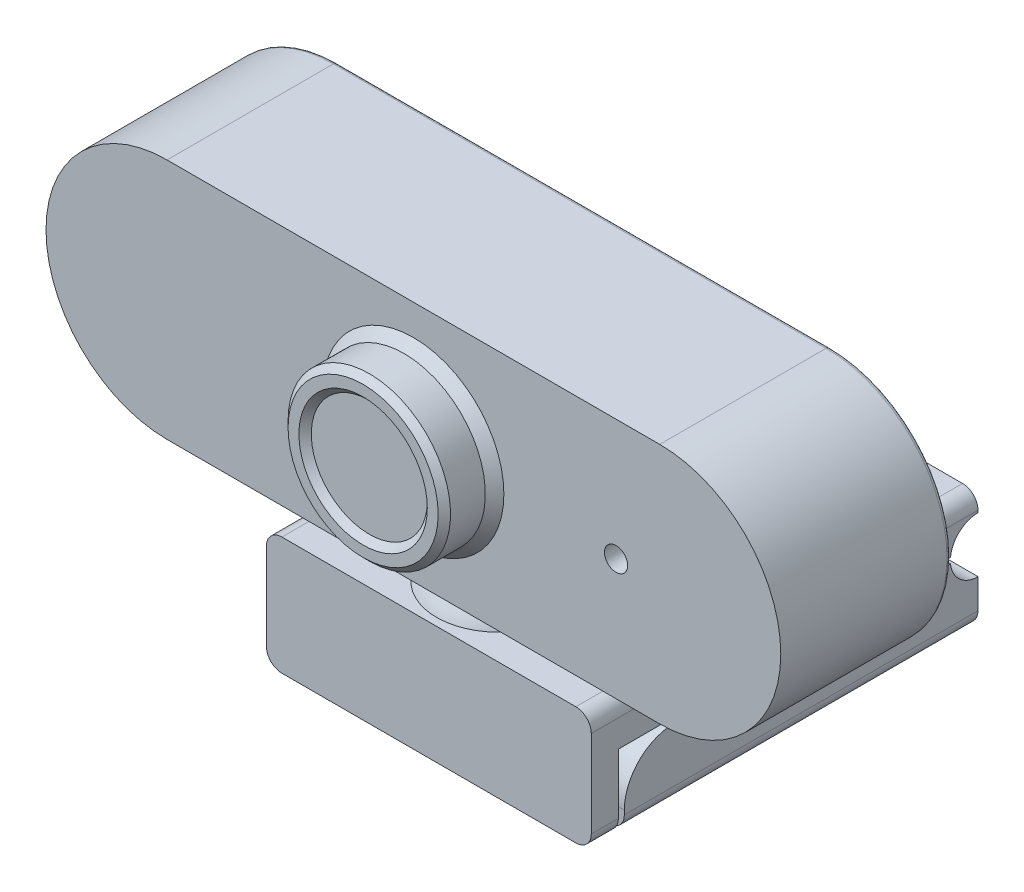
from build123d import *

# Parameters (mm, degrees)
RESSALTO_EXTRUS_O1_DEPTH   = 22
ESBO_O2_R                  = 10.5
ESBO_O2_R_2                = 7.5
RESSALTO_EXTRUS_O2_DEPTH   = 6.5
CHANFRO1_SIZE              = 0.8
CHANFRO2_SIZE              = 1.2
RESSALTO_EXTRUS_O3_START   = -1
ESBO_O3_R                  = 7.5
RESSALTO_EXTRUS_O3_DEPTH   = 1
ESBO_O4_R                  = 1.5
CORTE_EXTRUS_O1_DEPTH      = 18
ESBO_O5_R                  = 8
RESSALTO_EXTRUS_O4_DEPTH   = 3
FILETE2_R                  = 0.5
ESBO_O6_W                  = 42
ESBO_O6_H                  = 50
RESSALTO_EXTRUS_O5_DEPTH   = 15.25
FILETE3_R                  = 2
CORTE_EXTRUS_O2_DEPTH      = 19
CORTE_EXTRUS_O2_DEPTH_BACK = 70.25
CORTE_EXTRUS_O3_DEPTH      = 36
CORTE_EXTRUS_O3_DEPTH_BACK = 34.25
ESBO_O8_R                  = 3.575
ESBO_O9_R                  = 3.575
RESSALTO_EXTRUS_O6_DEPTH   = 10.85
ESBO_O10_R                 = 3.5
CORTE_EXTRUS_O4_DEPTH      = 5.7
ESBO_O13_R                 = 2
RESSALTO_EXTRUS_O7_DEPTH   = 10


with BuildPart() as part:
    # Esboço1 → Ressalto-extrusão1 (new body)
    with BuildSketch(Plane.XY):
        with BuildLine():
            Line((-31.85, 15.65), (31.85, 15.65))
            ThreePointArc((31.85, 15.65), (47.5, 0), (31.85, -15.65))
            Line((31.85, -15.65), (-31.85, -15.65))
            ThreePointArc((-31.85, -15.65), (-47.5, 0), (-31.85, 15.65))
        make_face()
    extrude(amount=RESSALTO_EXTRUS_O1_DEPTH)

    # Esboço2 → Ressalto-extrusão2 (add)
    with BuildSketch(Plane.XY.offset(22)):
        with Locations(Location((0, 0, 0), (0, 0, 180))):
            Circle(ESBO_O2_R)
        with Locations(Location((0, 0, 0), (0, 0, 180))):
            Circle(ESBO_O2_R_2, mode=Mode.SUBTRACT)
    extrude(amount=RESSALTO_EXTRUS_O2_DEPTH)

    # Chanfro1
    chanfro1_edges = [part.edges().sort_by_distance(p)[0] for p in [
        (10.5, 0, 28.5),
        (7.5, 0, 28.5),
    ]]
    chamfer(chanfro1_edges, length=CHANFRO1_SIZE)

    # Chanfro2
    chanfro2_edges = [part.edges().sort_by_distance(p)[0] for p in [
        (10.5, 0, 22),
    ]]
    chamfer(chanfro2_edges, length=CHANFRO2_SIZE)

    # Esboço3 → Ressalto-extrusão3 (add)
    with BuildSketch(Plane.XY.offset(27.7).offset(RESSALTO_EXTRUS_O3_START)):
        with Locations(Location((0, 0, 0), (0, 0, 180))):
            Circle(ESBO_O3_R)
    extrude(amount=RESSALTO_EXTRUS_O3_DEPTH)

    # Esboço4 → Corte-extrusão1 (cut)
    with BuildSketch(Plane.XY.offset(22)):
        with Locations((26.2, 0)):
            Circle(ESBO_O4_R)
    extrude(amount=-CORTE_EXTRUS_O1_DEPTH, mode=Mode.SUBTRACT)

    # Esboço5 → Ressalto-extrusão4 (add)
    with BuildSketch(Plane.XZ.offset(15.65)):
        with Locations(Location((0, 11, 0), (0, 0, 90))):
            Circle(ESBO_O5_R)
    extrude(amount=RESSALTO_EXTRUS_O4_DEPTH)

    # Filete2
    filete2_edges = [part.edges().sort_by_distance(p)[0] for p in [
        (0, -15.65, 3),
        (0, -18.65, 3),
        (0, 15.65, 0),
        (47.5, 0, 0),
        (0, -15.65, 0),
        (-47.5, 0, 0),
    ]]
    fillet(filete2_edges, radius=FILETE2_R)



with BuildPart() as body_2:
    # Esboço6 → Ressalto-extrusão5 (new body)
    with BuildSketch(Plane(origin=(0, -21.15, 0), x_dir=(-1, 0, 0), z_dir=(0, -1, 0))):
        with Locations((0, 5)):
            Rectangle(ESBO_O6_W, ESBO_O6_H)
    extrude(amount=RESSALTO_EXTRUS_O5_DEPTH)

    # Filete3
    filete3_edges = [body_2.edges().sort_by_distance(p)[0] for p in [
        (-21, -36.4, -5),
        (21, -36.4, -5),
        (-21, -21.15, -5),
        (21, -21.15, -5),
    ]]
    fillet(filete3_edges, radius=FILETE3_R)

    # Esboço7 → Corte-extrusão2 (cut, two sides: drawn at the far end of the back side and taken through both)
    with BuildSketch(Plane.ZY.offset(21).offset(-CORTE_EXTRUS_O2_DEPTH_BACK)):
        with BuildLine():
            Line((-30, -26.65), (16.5, -26.65))
            Line((16.5, -26.65), (16.5, -38.046721954))
            Line((16.5, -38.046721954), (15.730351624, -38.046721954))
            Line((15.730351624, -38.046721954), (15.730351624, -33.8624466))
            ThreePointArc((15.730351624, -33.8624466), (13.826545702, -29.266252522), (9.230351624, -27.3624466))
            Line((9.230351624, -27.3624466), (-30, -27.3624466))
            Line((-30, -27.3624466), (-31.616650622, -27.3624466))
            Line((-31.616650622, -27.3624466), (-31.616650622, -26.65))
            Line((-31.616650622, -26.65), (-30, -26.65))
        make_face()
    extrude(amount=CORTE_EXTRUS_O2_DEPTH + CORTE_EXTRUS_O2_DEPTH_BACK, mode=Mode.SUBTRACT)


with BuildPart() as corte_extrus_o2_piece_1:
    # of the separate pieces the step leaves, piece 1, a body of its own (corte_extrus_o2_pieces)
    add(body_2.part.solids().sort_by_distance((-21, -27.3624466, -30))[0])


with BuildPart() as corte_extrus_o2_piece_2:
    # of the separate pieces the step leaves, piece 2, a body of its own (corte_extrus_o2_pieces)
    add(body_2.part.solids().sort_by_distance((-21, -23.15, 20))[0])


with BuildPart() as corte_extrus_o3_tool:
    # Esboço8 → Corte-extrusão3 (new, two sides: drawn at the far end of the back side and taken through both)
    with BuildSketch(Plane(origin=(0, 0, 0), x_dir=(0, 0, -1), z_dir=(1, 0, 0)).offset(-CORTE_EXTRUS_O3_DEPTH_BACK)):
        with Locations((30, -27.0062233)):
            Circle(ESBO_O8_R)
    extrude(amount=CORTE_EXTRUS_O3_DEPTH + CORTE_EXTRUS_O3_DEPTH_BACK)


with BuildPart() as corte_extrus_o2_piece_1_1:
    add(corte_extrus_o2_piece_1.part)

    # Corte-extrusão3: cut by corte_extrus_o3_tool
    add(corte_extrus_o3_tool.part, mode=Mode.SUBTRACT)



with BuildPart() as corte_extrus_o2_piece_2_1:
    add(corte_extrus_o2_piece_2.part)

    # Corte-extrusão3: cut by corte_extrus_o3_tool
    add(corte_extrus_o3_tool.part, mode=Mode.SUBTRACT)


with BuildPart() as corte_extrus_o2_piece_1_2:
    add(corte_extrus_o2_piece_1_1.part)

    add(corte_extrus_o2_piece_2_1.part)  # Ressalto-extrusão6 merges Corte-extrusão2 piece 2
    # Esboço9 → Ressalto-extrusão6 (add, symmetric)
    with BuildSketch(Plane(origin=(0, 0, 0), x_dir=(0, 0, -1), z_dir=(1, 0, 0))):
        with Locations((30, -27.0062233)):
            Circle(ESBO_O9_R)
    extrude(amount=RESSALTO_EXTRUS_O6_DEPTH, both=True)

    # Esboço10 → Corte-extrusão4 (cut)
    with BuildSketch(Plane.XZ.offset(36.4)):
        with Locations(Location((0, -7.134824188, 0), (0, 0, 270))):
            Circle(ESBO_O10_R)
    extrude(amount=-CORTE_EXTRUS_O4_DEPTH, mode=Mode.SUBTRACT)


with BuildPart() as part_1:
    add(part.part)

    add(corte_extrus_o2_piece_1_2.part)  # Revolução1 merges Corte-extrusão2 piece 1
    # Esboço12 → Revolução1 (revolve)
    with BuildSketch(Plane.XY.offset(11), mode=Mode.PRIVATE) as revolu_o1_sk:
        with BuildLine():
            Line((0, -15.65), (0, -21.15))
            Line((0, -21.15), (-8, -21.15))
            ThreePointArc((-8, -21.15), (-4.85412196, -17.157640786), (0, -15.65))
        make_face()
    revolve(revolu_o1_sk.sketch.rotate(Axis((0, -15.65, 11), (0, -1, 0)), 90), axis=Axis((0, -15.65, 11), (0, -1, 0)))

    # Esboço13 → Ressalto-extrusão7 (add)
    with BuildSketch(Plane(origin=(0, 0, 0), x_dir=(-1, 0, 0), z_dir=(0, 0, -1))):
        with Locations(Location((-26.85, -7.65, 0), (0, 0, 180))):
            Circle(ESBO_O13_R)
    extrude(amount=RESSALTO_EXTRUS_O7_DEPTH)


solid = part_1.part
